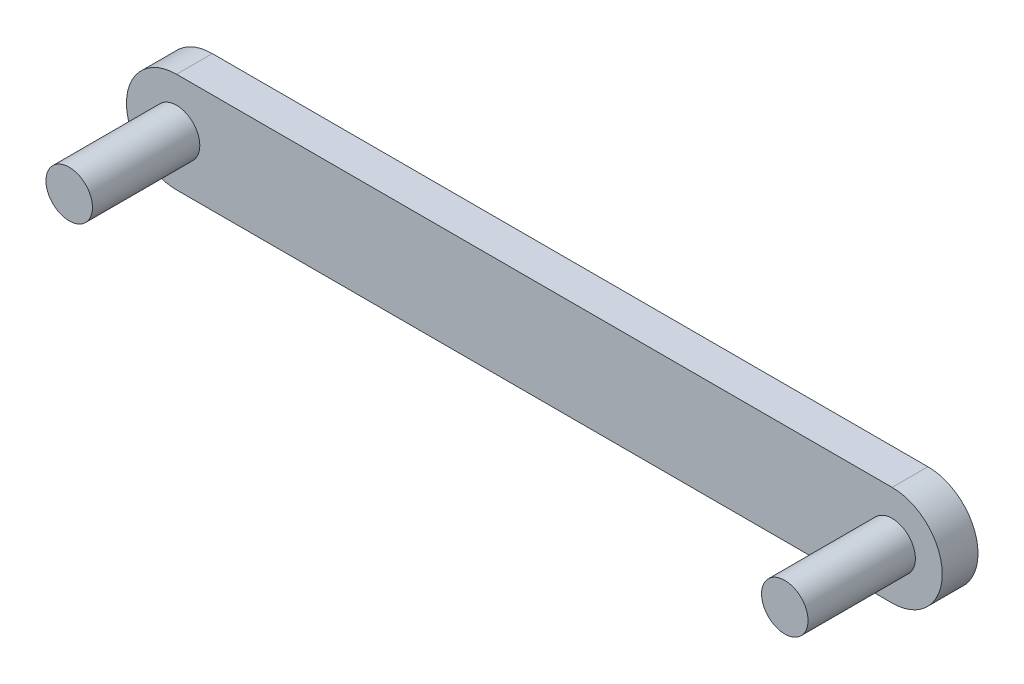
from build123d import *

# Parameters (mm, degrees)
BOSS_EXTRUDE1_DEPTH = 10
SKETCH2_R           = 6.5
BOSS_EXTRUDE2_DEPTH = 30


with BuildPart() as part:
    # Sketch1 → Boss-Extrude1 (new body)
    with BuildSketch(Plane.XY):
        with BuildLine():
            Line((100, -14), (-100, -14))
            ThreePointArc((-100, -14), (-114, 0), (-100, 14))
            Line((-100, 14), (100, 14))
            ThreePointArc((100, 14), (114, 0), (100, -14))
        make_face()
    extrude(amount=BOSS_EXTRUDE1_DEPTH)

    # Sketch2 → Boss-Extrude2 (add)
    with BuildSketch(Plane.XY.offset(10)):
        with Locations((100, 0)):
            Circle(SKETCH2_R)
        with Locations((-100, 0)):
            Circle(SKETCH2_R)
    extrude(amount=BOSS_EXTRUDE2_DEPTH)


solid = part.part
